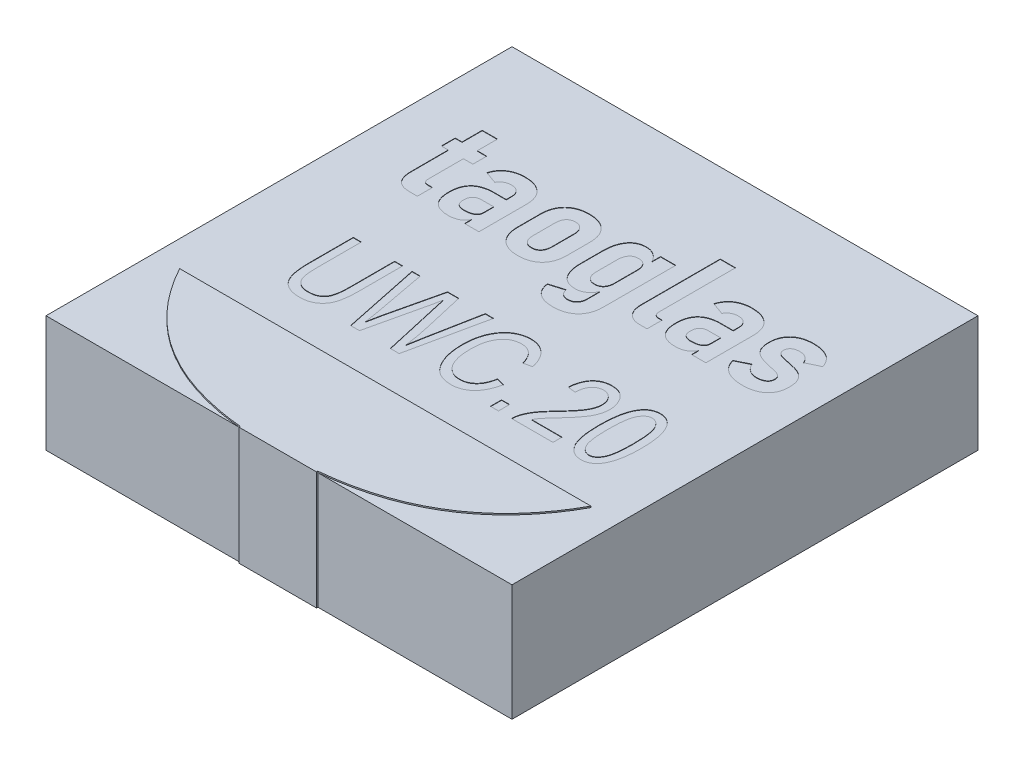
from build123d import *

# Parameters (mm, degrees)
SKETCH1_W           = 12
SKETCH1_H           = 12
BOSS_EXTRUDE1_DEPTH = 3
CUT_EXTRUDE1_DEPTH  = 0.01
SKETCH3_W           = 0.207792207
SKETCH3_H           = 0.285714285
CUT_EXTRUDE2_DEPTH  = 0.01
BOSS_EXTRUDE2_DEPTH = 0.035
SKETCH5_W           = 2
SKETCH5_H           = 3.035
BOSS_EXTRUDE3_DEPTH = 0.035
SKETCH6_W           = 1.8
SKETCH6_H           = 1.8
BOSS_EXTRUDE4_DEPTH = 0.035


with BuildPart() as part:
    # Sketch1 → Boss-Extrude1 (new body)
    with BuildSketch(Plane(origin=(0, 0, 0), x_dir=(1, 0, 0), z_dir=(0, 1, 0))):
        Rectangle(SKETCH1_W, SKETCH1_H)
    extrude(amount=BOSS_EXTRUDE1_DEPTH)

    # Sketch2 → Cut-Extrude1 (cut)
    # profile 1 of 11: a face of its own
    with BuildSketch(Plane(origin=(0, 3, 0), x_dir=(1, 0, 0), z_dir=(0, 1, 0))):
        with BuildLine():
            add(Edge.make_bspline(
                [(-4.082177573, 1.446921313), (-4.100452175, 1.447341427), (-4.135906195, 1.448156476), (-4.187220197, 1.453544619), (-4.2346967, 1.46334355), (-4.278580423, 1.476187937), (-4.318323244, 1.493621213), (-4.354377838, 1.514353743), (-4.386018142, 1.539618171), (-4.414162997, 1.568206993), (-4.438702104, 1.600431604), (-4.459369568, 1.636238764), (-4.477259094, 1.675106119), (-4.492048609, 1.717356499), (-4.502939084, 1.763136003), (-4.510972452, 1.811957411), (-4.516280305, 1.863978992), (-4.516714369, 1.899762091), (-4.516938124, 1.918207839)],
                knots=[0, 0, 0, 0, 1.191236669, 2.31108333, 3.357341899, 4.347642879, 5.285519943, 6.179695054, 7.05074459, 7.915916153, 8.788916218, 9.68309133, 10.605358333, 11.574453392, 12.595678506, 13.668425922, 14.798102147, 16, 16, 16, 16], degree=3))
            Line((-4.516938124, 1.918207839), (-4.518967345, 3.752116119))
            Line((-4.518967345, 3.752116119), (-4.12682043, 3.752116119))
            Line((-4.12682043, 3.752116119), (-4.12682043, 1.974518716))
            add(Edge.make_bspline(
                [(-4.12682043, 1.974518716), (-4.126350354, 1.964363804), (-4.125450969, 1.944934666), (-4.120926699, 1.917302047), (-4.111256442, 1.893563012), (-4.099577378, 1.872772427), (-4.083191339, 1.856764231), (-4.064170351, 1.844571469), (-4.041476909, 1.838088327), (-4.025564639, 1.83706625), (-4.017242508, 1.836531703)],
                knots=[0, 0, 0, 0, 1.225087291, 2.343928598, 3.350275553, 4.300622686, 5.193783201, 6.081349753, 6.996544259, 8, 8, 8, 8], degree=3))
            Line((-4.017242508, 1.836531703), (-3.883821241, 1.836531703))
            Line((-3.883821241, 1.836531703), (-3.883821241, 1.446921313))
            Line((-3.883821241, 1.446921313), (-4.082177573, 1.446921313))
        make_face()
    # profile 2 of 11: a face of its own
    with BuildSketch(Plane(origin=(0, 3, 0), x_dir=(1, 0, 0), z_dir=(0, 1, 0))):
        Polygon((-4.695002248, 2.875492742), (-4.695002248, 3.232635599), (-3.883821241, 3.232635599), (-3.883821241, 2.877014657), align=None)
    # profile 3 of 11: a face of its own
    with BuildSketch(Plane(origin=(0, 3, 0), x_dir=(1, 0, 0), z_dir=(0, 1, 0))):
        with BuildLine():
            Line((-2.666796079, 1.446921313), (-2.666796079, 2.657351508))
            add(Edge.make_bspline(
                [(-2.666796079, 2.657351508), (-2.667429235, 2.676374986), (-2.668632691, 2.712533435), (-2.681579146, 2.763217525), (-2.70255951, 2.807240876), (-2.732536643, 2.843884389), (-2.770629728, 2.87288561), (-2.816098819, 2.893825986), (-2.86926266, 2.906005823), (-2.907022366, 2.907283051), (-2.927043644, 2.907960274)],
                knots=[0, 0, 0, 0, 1.108007834, 2.106021114, 3.028382045, 3.933048714, 4.840938672, 5.798927425, 6.832928287, 8, 8, 8, 8], degree=3))
            add(Edge.make_bspline(
                [(-2.927043644, 2.907960274), (-2.941288479, 2.90750721), (-2.969311849, 2.906615911), (-3.010133896, 2.898545411), (-3.049252741, 2.886648756), (-3.085642505, 2.868675975), (-3.119212618, 2.846486276), (-3.149199296, 2.819579641), (-3.175291528, 2.788236593), (-3.188665331, 2.764290596), (-3.195408092, 2.75221758)],
                knots=[0, 0, 0, 0, 1.044624406, 2.05505343, 3.044444796, 4.038265424, 5.022972885, 5.989993332, 6.986601247, 8, 8, 8, 8], degree=3))
            Line((-3.195408092, 2.75221758), (-3.512473839, 2.866868554))
            add(Edge.make_bspline(
                [(-3.512473839, 2.866868554), (-3.507898959, 2.882375579), (-3.498902473, 2.912870089), (-3.479894394, 2.956060796), (-3.459623181, 2.997414601), (-3.435067806, 3.03552829), (-3.407252646, 3.070724952), (-3.377061273, 3.104032425), (-3.342718827, 3.133641979), (-3.306237387, 3.161416169), (-3.266607742, 3.185462269), (-3.224681197, 3.20711185), (-3.180189234, 3.225216266), (-3.133364715, 3.239982495), (-3.08429137, 3.251074459), (-3.032939676, 3.259090998), (-2.979069664, 3.264416299), (-2.942275904, 3.264871003), (-2.923492508, 3.265103132)],
                knots=[0, 0, 0, 0, 1.007667858, 1.981575232, 2.939405765, 3.878872876, 4.803290341, 5.736575898, 6.678468818, 7.628012353, 8.59428922, 9.566308898, 10.569437439, 11.587162715, 12.626264854, 13.705151769, 14.828468663, 16, 16, 16, 16], degree=3))
            add(Edge.make_bspline(
                [(-2.923492508, 3.265103132), (-2.899463722, 3.264592037), (-2.852650585, 3.263596317), (-2.784583947, 3.256584049), (-2.720580171, 3.244404684), (-2.660791503, 3.227260293), (-2.604849072, 3.205286254), (-2.552926173, 3.178592167), (-2.505533904, 3.146229429), (-2.462110077, 3.109719282), (-2.423704894, 3.06851092), (-2.389685512, 3.023731032), (-2.361924456, 2.974333625), (-2.338188924, 2.921525683), (-2.320840376, 2.864134833), (-2.307390491, 2.803138178), (-2.299917983, 2.738029571), (-2.298975068, 2.693387934), (-2.298492508, 2.670541443)],
                knots=[0, 0, 0, 0, 1.176545431, 2.29215836, 3.3461137, 4.362952169, 5.333208681, 6.28502252, 7.215158746, 8.137559586, 9.057280537, 9.968124497, 10.884260069, 11.825898436, 12.797531975, 13.814235576, 14.881379608, 16, 16, 16, 16], degree=3))
            Line((-2.298492508, 2.670541443), (-2.298492508, 1.446921313))
            Line((-2.298492508, 1.446921313), (-2.666796079, 1.446921313))
        make_face()
    # profile 4 of 11: a face of its own
    with BuildSketch(Plane(origin=(0, 3, 0), x_dir=(1, 0, 0), z_dir=(0, 1, 0))):
        with BuildLine():
            add(Edge.make_bspline(
                [(-3.056913774, 1.414453781), (-3.077727495, 1.414823769), (-3.117928312, 1.415538385), (-3.17633909, 1.42158332), (-3.230802782, 1.43226344), (-3.281400462, 1.446859634), (-3.328314866, 1.465145275), (-3.371211578, 1.487934663), (-3.409734227, 1.515602488), (-3.444879211, 1.546689147), (-3.475305723, 1.582550662), (-3.502005253, 1.622484987), (-3.524197353, 1.666879595), (-3.54256703, 1.715486923), (-3.556598981, 1.768375042), (-3.566619321, 1.825397293), (-3.572800732, 1.886618821), (-3.573497548, 1.928846021), (-3.573857767, 1.950675372)],
                knots=[0, 0, 0, 0, 1.168739368, 2.257370418, 3.292927306, 4.281748364, 5.211137899, 6.116140593, 7.001547475, 7.869100852, 8.744674127, 9.634957082, 10.560846446, 11.525661171, 12.548511358, 13.628992737, 14.774307786, 16, 16, 16, 16], degree=3))
            add(Edge.make_bspline(
                [(-3.573857767, 1.950675372), (-3.573309418, 1.973686511), (-3.572250688, 2.018115494), (-3.565863773, 2.082655172), (-3.554107555, 2.142718219), (-3.538137275, 2.198536344), (-3.517245182, 2.250035533), (-3.491203203, 2.29663685), (-3.461272158, 2.339473819), (-3.425736114, 2.377106043), (-3.386069509, 2.410863821), (-3.341531087, 2.43987399), (-3.292494367, 2.464338238), (-3.238942671, 2.483835274), (-3.181156234, 2.499841384), (-3.118800967, 2.510638514), (-3.051823274, 2.517423224), (-3.005693608, 2.51803397), (-2.981832605, 2.518349885)],
                knots=[0, 0, 0, 0, 1.174360603, 2.267408312, 3.304813126, 4.293371611, 5.226001371, 6.13370687, 7.012443309, 7.885526464, 8.767223756, 9.664740885, 10.590921095, 11.557465696, 12.568589945, 13.646822493, 14.782796878, 16, 16, 16, 16], degree=3))
            Line((-2.981832605, 2.518349885), (-2.654620754, 2.518349885))
            Line((-2.654620754, 2.518349885), (-2.628748189, 2.195196476))
            Line((-2.628748189, 2.195196476), (-2.974730332, 2.19367456))
            add(Edge.make_bspline(
                [(-2.974730332, 2.19367456), (-2.99306347, 2.193349125), (-3.027594206, 2.192736164), (-3.076064874, 2.181333351), (-3.117757299, 2.162240708), (-3.15162492, 2.133791573), (-3.178444422, 2.09786743), (-3.195666779, 2.053357692), (-3.206564374, 2.001770385), (-3.207229545, 1.964776037), (-3.207583417, 1.945095015)],
                knots=[0, 0, 0, 0, 1.119640328, 2.108859057, 3.025616394, 3.900328462, 4.788472712, 5.739984025, 6.797669766, 8, 8, 8, 8], degree=3))
            add(Edge.make_bspline(
                [(-3.207583417, 1.945095015), (-3.207273526, 1.928773445), (-3.206686996, 1.897881652), (-3.194958804, 1.854838237), (-3.177008616, 1.817534271), (-3.149352787, 1.787514117), (-3.113764426, 1.765283403), (-3.071178799, 1.748724503), (-3.020901818, 1.740097671), (-2.985074777, 1.739464394), (-2.966106144, 1.739129106)],
                knots=[0, 0, 0, 0, 1.069368935, 2.023991879, 2.909008863, 3.766792373, 4.667246662, 5.645845189, 6.753592325, 8, 8, 8, 8], degree=3))
            add(Edge.make_bspline(
                [(-2.966106144, 1.739129106), (-2.942894158, 1.740334767), (-2.899096293, 1.742609686), (-2.838122803, 1.75310898), (-2.786149964, 1.768604017), (-2.7425689, 1.789045123), (-2.708326557, 1.817143204), (-2.683326973, 1.852517831), (-2.668907363, 1.895688315), (-2.667524447, 1.926721125), (-2.666796079, 1.943065794)],
                knots=[0, 0, 0, 0, 1.362019611, 2.569946089, 3.617508551, 4.535416919, 5.373309674, 6.184796531, 7.043950598, 8, 8, 8, 8], degree=3))
            Line((-2.666796079, 1.943065794), (-2.632299326, 1.744202157))
            add(Edge.make_bspline(
                [(-2.632299326, 1.744202157), (-2.635184172, 1.7264977), (-2.640765207, 1.69224659), (-2.657119825, 1.644007436), (-2.677607014, 1.59981475), (-2.704417822, 1.560805739), (-2.734994506, 1.525755648), (-2.770130616, 1.495822527), (-2.809479468, 1.470659281), (-2.852483467, 1.449761251), (-2.899403361, 1.434544978), (-2.949004265, 1.422385059), (-3.001967129, 1.416133386), (-3.038299337, 1.415022786), (-3.056913774, 1.414453781)],
                knots=[0, 0, 0, 0, 1.085248998, 2.099526862, 3.075822976, 4.027942046, 4.957233502, 5.887541379, 6.814173588, 7.781229844, 8.776064882, 9.797615496, 10.871630686, 12, 12, 12, 12], degree=3))
        make_face()
    # profile 5 of 11: a face of its own
    with BuildSketch(Plane(origin=(0, 3, 0), x_dir=(1, 0, 0), z_dir=(0, 1, 0))):
        with BuildLine():
            add(Edge.make_bspline(
                [(-1.269170267, 1.414453781), (-1.29354723, 1.414869542), (-1.34125973, 1.415683303), (-1.410627342, 1.424100408), (-1.476135126, 1.436910411), (-1.537059317, 1.456100994), (-1.594549349, 1.478870641), (-1.647009629, 1.509031574), (-1.695947569, 1.543287444), (-1.74031673, 1.583204366), (-1.779902599, 1.627727662), (-1.813992671, 1.676923831), (-1.843318748, 1.729974233), (-1.86629921, 1.787553403), (-1.884860694, 1.849136013), (-1.897775393, 1.914879493), (-1.905618449, 1.984979164), (-1.906098568, 2.033006426), (-1.906345592, 2.057716768)],
                knots=[0, 0, 0, 0, 1.136233247, 2.223924638, 3.253914315, 4.244165647, 5.198961104, 6.131116221, 7.058824439, 7.980243949, 8.907549894, 9.830722435, 10.765941232, 11.728035834, 12.715992404, 13.761442677, 14.848247546, 16, 16, 16, 16], degree=3))
            Line((-1.906345592, 2.057716768), (-1.906345592, 2.630464333))
            add(Edge.make_bspline(
                [(-1.906345592, 2.630464333), (-1.906092767, 2.655004241), (-1.905601462, 2.702691658), (-1.897860293, 2.772141703), (-1.884672677, 2.837307505), (-1.866534841, 2.898354354), (-1.843149667, 2.955273405), (-1.814140247, 3.007649241), (-1.779874629, 3.055922204), (-1.7401511, 3.099445514), (-1.695919907, 3.138786124), (-1.647150081, 3.172702843), (-1.59424462, 3.201459079), (-1.53719546, 3.224699683), (-1.476017118, 3.242923861), (-1.410683846, 3.256186157), (-1.341215345, 3.263679032), (-1.293538651, 3.264621447), (-1.269170267, 3.265103132)],
                knots=[0, 0, 0, 0, 1.150912406, 2.236521831, 3.272853087, 4.266892441, 5.220231884, 6.154258736, 7.070147418, 7.99134763, 8.913162682, 9.842019137, 10.772230104, 11.732904174, 12.726943528, 13.763274784, 14.856771039, 16, 16, 16, 16], degree=3))
            add(Edge.make_bspline(
                [(-1.269170267, 3.265103132), (-1.244801283, 3.264629138), (-1.197291527, 3.263705039), (-1.127997696, 3.256145219), (-1.062840017, 3.242904879), (-1.001768641, 3.22482231), (-0.945010456, 3.201305966), (-0.892271125, 3.172857526), (-0.84394751, 3.138749172), (-0.800166259, 3.099461987), (-0.761055778, 3.055737375), (-0.726622508, 3.007812684), (-0.698342566, 2.955115908), (-0.674850024, 2.898369672), (-0.656562557, 2.837366446), (-0.644211009, 2.772073528), (-0.636240185, 2.702701286), (-0.635781908, 2.655007512), (-0.635546079, 2.630464333)],
                knots=[0, 0, 0, 0, 1.145973614, 2.23418936, 3.273008631, 4.269434466, 5.225062677, 6.157506887, 7.082082515, 8.000170054, 8.918257593, 9.836345132, 10.768789341, 11.724417553, 12.720843388, 13.758108748, 14.846324494, 16, 16, 16, 16], degree=3))
            Line((-0.635546079, 2.630464333), (-0.635546079, 2.052643716))
            add(Edge.make_bspline(
                [(-0.635546079, 2.052643716), (-0.635789995, 2.028101247), (-0.63626566, 1.980240673), (-0.644169742, 1.910692729), (-0.656550689, 1.845228832), (-0.674948694, 1.784101548), (-0.698332284, 1.726987193), (-0.726613149, 1.673784637), (-0.761062944, 1.625373146), (-0.800007578, 1.58114004), (-0.843944589, 1.541798185), (-0.892415256, 1.507820053), (-0.944842374, 1.478591285), (-1.001895553, 1.455480077), (-1.062661032, 1.436269302), (-1.128123177, 1.424322402), (-1.197237012, 1.415606156), (-1.244789296, 1.414844366), (-1.269170267, 1.414453781)],
                knots=[0, 0, 0, 0, 1.150786461, 2.244163054, 3.278830884, 4.272761459, 5.233330401, 6.170417134, 7.092677431, 8.014391608, 8.930180063, 9.85244036, 10.786365001, 11.739600119, 12.735839332, 13.770507161, 14.856896144, 16, 16, 16, 16], degree=3))
        make_face()
        with BuildLine():
            add(Edge.make_bspline(
                [(-1.271199488, 1.771596638), (-1.252643798, 1.772288226), (-1.217285078, 1.773606078), (-1.167864628, 1.788663516), (-1.124335163, 1.81131833), (-1.088864287, 1.845179032), (-1.05995529, 1.886558498), (-1.040543068, 1.936677124), (-1.028107181, 1.993694874), (-1.026838816, 2.034307062), (-1.026171079, 2.055687547)],
                knots=[0, 0, 0, 0, 1.043057802, 1.987594517, 2.888009663, 3.785541369, 4.724670203, 5.712877265, 6.795933051, 8, 8, 8, 8], degree=3))
            Line((-1.026171079, 2.055687547), (-1.026171079, 2.627420502))
            add(Edge.make_bspline(
                [(-1.026171079, 2.627420502), (-1.026817937, 2.648637524), (-1.028041187, 2.688760281), (-1.040652145, 2.745058586), (-1.059816576, 2.794465586), (-1.089015261, 2.835044285), (-1.124638638, 2.868095282), (-1.167604503, 2.891678405), (-1.217409983, 2.90573058), (-1.252670574, 2.90719221), (-1.271199488, 2.907960274)],
                knots=[0, 0, 0, 0, 1.203141769, 2.275218587, 3.261641283, 4.1917873, 5.089270432, 6.000779579, 6.94943949, 8, 8, 8, 8], degree=3))
            add(Edge.make_bspline(
                [(-1.271199488, 2.907960274), (-1.289390042, 2.907183297), (-1.324148735, 2.905698642), (-1.373434661, 2.891593722), (-1.41625148, 2.867938837), (-1.45241293, 2.835249552), (-1.481432384, 2.794324325), (-1.50140139, 2.745200287), (-1.513798484, 2.688737237), (-1.515055748, 2.648629554), (-1.515720592, 2.627420502)],
                knots=[0, 0, 0, 0, 1.033686927, 1.97517941, 2.888695558, 3.795287172, 4.727481225, 5.719771738, 6.794209101, 8, 8, 8, 8], degree=3))
            Line((-1.515720592, 2.627420502), (-1.515720592, 2.055687547))
            add(Edge.make_bspline(
                [(-1.515720592, 2.055687547), (-1.515034836, 2.034314967), (-1.513732245, 1.993717795), (-1.50151313, 1.936535725), (-1.481290619, 1.886699783), (-1.45256819, 1.844972846), (-1.41655531, 1.811470509), (-1.373174456, 1.788747701), (-1.324273285, 1.773641456), (-1.289416465, 1.772298498), (-1.271199488, 1.771596638)],
                knots=[0, 0, 0, 0, 1.206707764, 2.292138957, 3.28615018, 4.227338753, 5.133869778, 6.036259756, 6.973704081, 8, 8, 8, 8], degree=3))
        make_face(mode=Mode.SUBTRACT)
    # profile 6 of 11: a face of its own
    with BuildSketch(Plane(origin=(0, 3, 0), x_dir=(1, 0, 0), z_dir=(0, 1, 0))):
        with BuildLine():
            add(Edge.make_bspline(
                [(0.318187687, 0.724518716), (0.298047045, 0.72469497), (0.258696956, 0.72503933), (0.201310264, 0.731101208), (0.146966653, 0.73926428), (0.096032714, 0.751750756), (0.047906352, 0.766576912), (0.003337182, 0.786214833), (-0.038575447, 0.808249272), (-0.076832359, 0.834501871), (-0.112081146, 0.863677806), (-0.142988526, 0.897206587), (-0.171222458, 0.933272093), (-0.195604669, 0.972899867), (-0.215814396, 1.016116923), (-0.233333484, 1.062278088), (-0.24624632, 1.112211023), (-0.252420272, 1.146721322), (-0.255574488, 1.16435232)],
                knots=[0, 0, 0, 0, 1.205301849, 2.35487697, 3.451880311, 4.493170122, 5.492252228, 6.462809998, 7.40506802, 8.323411719, 9.236100227, 10.13867913, 11.04804784, 11.975390222, 12.917430608, 13.901051796, 14.92766644, 16, 16, 16, 16], degree=3))
            Line((-0.255574488, 1.16435232), (-0.257096404, 1.165874235))
            Line((-0.257096404, 1.165874235), (0.11628022, 1.277988683))
            add(Edge.make_bspline(
                [(0.11628022, 1.277988683), (0.120466826, 1.262815989), (0.128501856, 1.233696203), (0.146253956, 1.193377644), (0.169219888, 1.159148306), (0.196462809, 1.130495496), (0.228250352, 1.108405093), (0.264234021, 1.093207101), (0.303601042, 1.083089216), (0.331311424, 1.082146875), (0.345582168, 1.081661573)],
                knots=[0, 0, 0, 0, 1.145028287, 2.197564733, 3.191211535, 4.131565532, 5.060486474, 5.986793033, 6.96320588, 8, 8, 8, 8], degree=3))
            add(Edge.make_bspline(
                [(0.345582168, 1.081661573), (0.36375461, 1.082537579), (0.398552077, 1.084214998), (0.448059223, 1.097028072), (0.491540082, 1.119009), (0.528173443, 1.150349132), (0.558195565, 1.189076194), (0.578287759, 1.236245806), (0.590781565, 1.289847547), (0.591667126, 1.327965588), (0.592132492, 1.3479968)],
                knots=[0, 0, 0, 0, 1.057951135, 2.025815749, 2.955569453, 3.871437606, 4.81337937, 5.783748165, 6.835349051, 8, 8, 8, 8], degree=3))
            Line((0.592132492, 1.3479968), (0.593654408, 3.232635599))
            Line((0.593654408, 3.232635599), (0.984279408, 3.232635599))
            Line((0.984279408, 3.232635599), (0.984279408, 1.366767093))
            add(Edge.make_bspline(
                [(0.984279408, 1.366767093), (0.983915413, 1.342048164), (0.983204971, 1.293801947), (0.974098192, 1.223592971), (0.960728959, 1.157682742), (0.94193777, 1.095826424), (0.917011142, 1.038609905), (0.886904468, 0.985275605), (0.85132384, 0.936252148), (0.809910012, 0.892215805), (0.764333903, 0.852305318), (0.713555464, 0.818218948), (0.658435418, 0.789207558), (0.598960508, 0.765331838), (0.534987405, 0.747136055), (0.466746049, 0.734120121), (0.393984839, 0.725727465), (0.343915229, 0.724928997), (0.318187687, 0.724518716)],
                knots=[0, 0, 0, 0, 1.127370786, 2.200393757, 3.225038303, 4.194122408, 5.144622546, 6.067367868, 6.984253609, 7.901593912, 8.820685424, 9.743204824, 10.685619201, 11.658659081, 12.662517363, 13.715907218, 14.826352111, 16, 16, 16, 16], degree=3))
        make_face()
    # profile 7 of 11: a face of its own
    with BuildSketch(Plane(origin=(0, 3, 0), x_dir=(1, 0, 0), z_dir=(0, 1, 0))):
        with BuildLine():
            add(Edge.make_bspline(
                [(0.205058629, 1.414453781), (0.186263532, 1.414926958), (0.149526978, 1.415851822), (0.095894608, 1.423491154), (0.04551734, 1.436641776), (-0.001385014, 1.45505162), (-0.045183298, 1.478011535), (-0.085577566, 1.506540793), (-0.121945631, 1.541040827), (-0.15590081, 1.579510405), (-0.184944843, 1.623564233), (-0.211221157, 1.671402397), (-0.232578464, 1.723841992), (-0.251189165, 1.780008474), (-0.265213912, 1.840646084), (-0.275187047, 1.905425687), (-0.281274261, 1.974406074), (-0.282392661, 2.021685709), (-0.282968969, 2.046048748)],
                knots=[0, 0, 0, 0, 0.998875488, 1.952383794, 2.872550872, 3.760673895, 4.625281568, 5.495804423, 6.379960249, 7.284850293, 8.217362134, 9.178762493, 10.182158532, 11.222643449, 12.321639619, 13.486291024, 14.704694071, 16, 16, 16, 16], degree=3))
            Line((-0.282968969, 2.046048748), (-0.282968969, 2.627927807))
            add(Edge.make_bspline(
                [(-0.282968969, 2.627927807), (-0.282393852, 2.652460306), (-0.281277541, 2.700078275), (-0.275170972, 2.769558457), (-0.265264296, 2.834865448), (-0.251018914, 2.895881824), (-0.233233554, 2.952768491), (-0.211668894, 3.005575555), (-0.185532414, 3.054013727), (-0.156162641, 3.09831101), (-0.123367335, 3.138180964), (-0.086419523, 3.172248607), (-0.046701213, 3.201699563), (-0.003134826, 3.224952356), (0.043335883, 3.243326332), (0.092993933, 3.256620651), (0.146133184, 3.264349865), (0.182711169, 3.264847442), (0.201507492, 3.265103132)],
                knots=[0, 0, 0, 0, 1.301027643, 2.525315178, 3.69591381, 4.800891658, 5.84456841, 6.853735481, 7.820622285, 8.758249379, 9.668725885, 10.550670002, 11.416975573, 12.28365235, 13.161209114, 14.061739611, 15.003986428, 16, 16, 16, 16], degree=3))
            add(Edge.make_bspline(
                [(0.201507492, 3.265103132), (0.223748537, 3.264358252), (0.267763275, 3.262884145), (0.332362908, 3.246943883), (0.393818042, 3.220204003), (0.451737903, 3.182692282), (0.505412982, 3.13624712), (0.55308628, 3.080334919), (0.595104005, 3.016131113), (0.616926748, 2.968485311), (0.628151161, 2.943978943)],
                knots=[0, 0, 0, 0, 0.939230242, 1.858724415, 2.794188441, 3.76246683, 4.766415157, 5.785863634, 6.861170619, 8, 8, 8, 8], degree=3))
            Line((0.628151161, 2.943978943), (0.592132492, 2.636551995))
            add(Edge.make_bspline(
                [(0.592132492, 2.636551995), (0.592109095, 2.650098218), (0.592063576, 2.67645241), (0.586791069, 2.714536774), (0.578266137, 2.749970816), (0.565980998, 2.782402308), (0.551132258, 2.812141008), (0.532093617, 2.837547817), (0.510418052, 2.859496912), (0.485378288, 2.877369829), (0.456980316, 2.890998947), (0.425708379, 2.901499191), (0.390904343, 2.906703827), (0.366733372, 2.907531381), (0.354206356, 2.907960274)],
                knots=[0, 0, 0, 0, 1.184568575, 2.304579583, 3.356493581, 4.368273284, 5.334865166, 6.255598593, 7.134821175, 8.026171538, 8.93311806, 9.883363628, 10.903017221, 12, 12, 12, 12], degree=3))
            add(Edge.make_bspline(
                [(0.354206356, 2.907960274), (0.335500038, 2.907053441), (0.299809616, 2.905323262), (0.249244148, 2.890254251), (0.205760699, 2.864369707), (0.169649772, 2.828503068), (0.14162509, 2.783936209), (0.121507443, 2.731904084), (0.108688928, 2.672661498), (0.106681764, 2.630703215), (0.105626811, 2.608650209)],
                knots=[0, 0, 0, 0, 1.020864556, 1.947742261, 2.851238358, 3.759684639, 4.70318682, 5.707218961, 6.794928901, 8, 8, 8, 8], degree=3))
            Line((0.105626811, 2.608650209), (0.105626811, 2.058731378))
            add(Edge.make_bspline(
                [(0.105626811, 2.058731378), (0.106295198, 2.037017643), (0.107560537, 1.995910912), (0.119944444, 1.937943961), (0.139931613, 1.887366395), (0.168773433, 1.844826545), (0.205415234, 1.810918473), (0.249797382, 1.787314333), (0.300767343, 1.773265508), (0.336863453, 1.772169462), (0.355728272, 1.771596638)],
                knots=[0, 0, 0, 0, 1.201702592, 2.27496858, 3.266775193, 4.197194913, 5.099153499, 6.004755004, 6.957230176, 8, 8, 8, 8], degree=3))
            add(Edge.make_bspline(
                [(0.355728272, 1.771596638), (0.367926877, 1.771786424), (0.391451951, 1.772152427), (0.42525342, 1.777831245), (0.456310125, 1.787418818), (0.484432514, 1.801707516), (0.509412209, 1.820411889), (0.532064123, 1.841944486), (0.550427745, 1.86826952), (0.56613758, 1.897476445), (0.578307584, 1.930271344), (0.586676758, 1.965713484), (0.592083429, 2.003606859), (0.592115832, 2.029626606), (0.592132492, 2.043004917)],
                knots=[0, 0, 0, 0, 1.071013031, 2.065454304, 3.000834164, 3.918091259, 4.821762204, 5.736124976, 6.651815448, 7.62922966, 8.64509703, 9.715697498, 10.825503262, 12, 12, 12, 12], degree=3))
            Line((0.592132492, 2.043004917), (0.615975837, 1.725431865))
            add(Edge.make_bspline(
                [(0.615975837, 1.725431865), (0.607445296, 1.703008876), (0.590715477, 1.659033635), (0.555653784, 1.59850496), (0.513297761, 1.544846096), (0.464167285, 1.49844361), (0.408307822, 1.460821734), (0.346056192, 1.433502415), (0.277368082, 1.417661811), (0.229660968, 1.415545271), (0.205058629, 1.414453781)],
                knots=[0, 0, 0, 0, 1.039952667, 2.039521501, 3.021858379, 3.998034276, 4.960875327, 5.930406727, 6.932720231, 8, 8, 8, 8], degree=3))
        make_face()
    # profile 8 of 11: a face of its own
    with BuildSketch(Plane(origin=(0, 3, 0), x_dir=(1, 0, 0), z_dir=(0, 1, 0))):
        with BuildLine():
            Line((1.808143044, 3.946921313), (1.808143044, 1.975026021))
            add(Edge.make_bspline(
                [(1.808143044, 1.975026021), (1.808471251, 1.964674335), (1.809091212, 1.945120669), (1.815361328, 1.91748082), (1.825439864, 1.893281324), (1.839622171, 1.872641463), (1.858028704, 1.856521909), (1.879567535, 1.844565297), (1.904682368, 1.838099307), (1.922252649, 1.837069108), (1.931418207, 1.836531703)],
                knots=[0, 0, 0, 0, 1.181340194, 2.231475248, 3.218550972, 4.162104532, 5.065626072, 5.990996165, 6.952000817, 8, 8, 8, 8], degree=3))
            Line((1.931418207, 1.836531703), (2.03034272, 1.836531703))
            Line((2.03034272, 1.836531703), (2.03034272, 1.446921313))
            Line((2.03034272, 1.446921313), (1.845683629, 1.446921313))
            add(Edge.make_bspline(
                [(1.845683629, 1.446921313), (1.829096658, 1.447335487), (1.796840385, 1.448140921), (1.749938366, 1.453667153), (1.705889703, 1.463271688), (1.664678556, 1.47713417), (1.626091306, 1.49413391), (1.590512093, 1.515280349), (1.557867805, 1.540349034), (1.527925455, 1.56915189), (1.501541697, 1.601817669), (1.478607061, 1.637548397), (1.459112953, 1.676459836), (1.443615102, 1.718927232), (1.430747606, 1.764308899), (1.422529169, 1.81313863), (1.416495343, 1.864958732), (1.41616588, 1.900770734), (1.415996129, 1.91922245)],
                knots=[0, 0, 0, 0, 1.096532794, 2.132400368, 3.117048326, 4.071596503, 5.002411487, 5.899725498, 6.800861876, 7.718014517, 8.639924558, 9.57026945, 10.520223694, 11.510756622, 12.555036251, 13.633988453, 14.780940183, 16, 16, 16, 16], degree=3))
            Line((1.415996129, 1.91922245), (1.415996129, 3.946921313))
            Line((1.415996129, 3.946921313), (1.808143044, 3.946921313))
        make_face()
    # profile 9 of 11: a face of its own
    with BuildSketch(Plane(origin=(0, 3, 0), x_dir=(1, 0, 0), z_dir=(0, 1, 0))):
        with BuildLine():
            Line((3.177359765, 1.446921313), (3.177359765, 2.657351508))
            add(Edge.make_bspline(
                [(3.177359765, 2.657351508), (3.176726609, 2.676374986), (3.175523153, 2.712533435), (3.162576698, 2.763217525), (3.141596334, 2.807240876), (3.111619201, 2.843884389), (3.073526116, 2.87288561), (3.028057025, 2.893825986), (2.974893185, 2.906005823), (2.937133478, 2.907283051), (2.9171122, 2.907960274)],
                knots=[0, 0, 0, 0, 1.108007834, 2.106021114, 3.028382045, 3.933048714, 4.840938672, 5.798927425, 6.832928287, 8, 8, 8, 8], degree=3))
            add(Edge.make_bspline(
                [(2.9171122, 2.907960274), (2.902867365, 2.90750721), (2.874843995, 2.906615911), (2.834021948, 2.898545411), (2.794903103, 2.886648756), (2.758513339, 2.868675975), (2.724943227, 2.846486276), (2.694956549, 2.819579641), (2.668864316, 2.788236593), (2.655490513, 2.764290596), (2.648747752, 2.75221758)],
                knots=[0, 0, 0, 0, 1.044624406, 2.05505343, 3.044444796, 4.038265424, 5.022972885, 5.989993332, 6.986601247, 8, 8, 8, 8], degree=3))
            Line((2.648747752, 2.75221758), (2.331682005, 2.866868554))
            add(Edge.make_bspline(
                [(2.331682005, 2.866868554), (2.336256886, 2.882375579), (2.345253371, 2.912870089), (2.36426145, 2.956060796), (2.384532664, 2.997414601), (2.409088038, 3.03552829), (2.436903198, 3.070724952), (2.467094571, 3.104032425), (2.501437017, 3.133641979), (2.537918458, 3.161416169), (2.577548103, 3.185462269), (2.619474647, 3.20711185), (2.66396661, 3.225216266), (2.710791129, 3.239982495), (2.759864474, 3.251074459), (2.811216168, 3.259090998), (2.86508618, 3.264416299), (2.90187994, 3.264871003), (2.920663337, 3.265103132)],
                knots=[0, 0, 0, 0, 1.007667858, 1.981575232, 2.939405765, 3.878872876, 4.803290341, 5.736575898, 6.678468818, 7.628012353, 8.59428922, 9.566308898, 10.569437439, 11.587162715, 12.626264854, 13.705151769, 14.828468663, 16, 16, 16, 16], degree=3))
            add(Edge.make_bspline(
                [(2.920663337, 3.265103132), (2.944692122, 3.264592037), (2.991505259, 3.263596317), (3.059571897, 3.256584049), (3.123575673, 3.244404684), (3.183364341, 3.227260293), (3.239306772, 3.205286254), (3.291229671, 3.178592167), (3.33862194, 3.146229429), (3.382045767, 3.109719282), (3.42045095, 3.06851092), (3.454470332, 3.023731032), (3.482231388, 2.974333625), (3.50596692, 2.921525683), (3.523315468, 2.864134833), (3.536765353, 2.803138178), (3.544237861, 2.738029571), (3.545180776, 2.693387934), (3.545663337, 2.670541443)],
                knots=[0, 0, 0, 0, 1.176545431, 2.29215836, 3.3461137, 4.362952169, 5.333208681, 6.28502252, 7.215158746, 8.137559586, 9.057280537, 9.968124497, 10.884260069, 11.825898436, 12.797531975, 13.814235576, 14.881379608, 16, 16, 16, 16], degree=3))
            Line((3.545663337, 2.670541443), (3.545663337, 1.446921313))
            Line((3.545663337, 1.446921313), (3.177359765, 1.446921313))
        make_face()
    # profile 10 of 11: a face of its own
    with BuildSketch(Plane(origin=(0, 3, 0), x_dir=(1, 0, 0), z_dir=(0, 1, 0))):
        with BuildLine():
            add(Edge.make_bspline(
                [(2.78724207, 1.414453781), (2.766428349, 1.414823769), (2.726227532, 1.415538385), (2.667816754, 1.42158332), (2.613353062, 1.43226344), (2.562755383, 1.446859634), (2.515840978, 1.465145275), (2.472944266, 1.487934663), (2.434421617, 1.515602488), (2.399276633, 1.546689147), (2.368850121, 1.582550662), (2.342150591, 1.622484987), (2.319958491, 1.666879595), (2.301588814, 1.715486923), (2.287556863, 1.768375042), (2.277536523, 1.825397293), (2.271355112, 1.886618821), (2.270658296, 1.928846021), (2.270298077, 1.950675372)],
                knots=[0, 0, 0, 0, 1.168739368, 2.257370418, 3.292927306, 4.281748364, 5.211137899, 6.116140593, 7.001547475, 7.869100852, 8.744674127, 9.634957082, 10.560846446, 11.525661171, 12.548511358, 13.628992737, 14.774307786, 16, 16, 16, 16], degree=3))
            add(Edge.make_bspline(
                [(2.270298077, 1.950675372), (2.270846426, 1.973686511), (2.271905156, 2.018115494), (2.278292071, 2.082655172), (2.29004829, 2.142718219), (2.306018569, 2.198536344), (2.326910662, 2.250035533), (2.352952641, 2.29663685), (2.382883686, 2.339473819), (2.418419731, 2.377106043), (2.458086335, 2.410863821), (2.502624757, 2.43987399), (2.551661477, 2.464338238), (2.605213173, 2.483835274), (2.662999611, 2.499841384), (2.725354878, 2.510638514), (2.79233257, 2.517423224), (2.838462237, 2.51803397), (2.862323239, 2.518349885)],
                knots=[0, 0, 0, 0, 1.174360603, 2.267408312, 3.304813126, 4.293371611, 5.226001371, 6.13370687, 7.012443309, 7.885526464, 8.767223756, 9.664740885, 10.590921095, 11.557465696, 12.568589945, 13.646822493, 14.782796878, 16, 16, 16, 16], degree=3))
            Line((2.862323239, 2.518349885), (3.18953509, 2.518349885))
            Line((3.18953509, 2.518349885), (3.215407655, 2.195196476))
            Line((3.215407655, 2.195196476), (2.869425512, 2.19367456))
            add(Edge.make_bspline(
                [(2.869425512, 2.19367456), (2.851092374, 2.193349125), (2.816561638, 2.192736164), (2.76809097, 2.181333351), (2.726398546, 2.162240708), (2.692530925, 2.133791573), (2.665711423, 2.09786743), (2.648489065, 2.053357692), (2.63759147, 2.001770385), (2.636926299, 1.964776037), (2.636572427, 1.945095015)],
                knots=[0, 0, 0, 0, 1.119640328, 2.108859057, 3.025616394, 3.900328462, 4.788472712, 5.739984025, 6.797669766, 8, 8, 8, 8], degree=3))
            add(Edge.make_bspline(
                [(2.636572427, 1.945095015), (2.636882318, 1.928773445), (2.637468848, 1.897881652), (2.64919704, 1.854838237), (2.667147228, 1.817534271), (2.694803057, 1.787514117), (2.730391418, 1.765283403), (2.772977046, 1.748724503), (2.823254026, 1.740097671), (2.859081067, 1.739464394), (2.8780497, 1.739129106)],
                knots=[0, 0, 0, 0, 1.069368935, 2.023991879, 2.909008863, 3.766792373, 4.667246662, 5.645845189, 6.753592325, 8, 8, 8, 8], degree=3))
            add(Edge.make_bspline(
                [(2.8780497, 1.739129106), (2.901261686, 1.740334767), (2.945059551, 1.742609686), (3.006033042, 1.75310898), (3.05800588, 1.768604017), (3.101586944, 1.789045123), (3.135829287, 1.817143204), (3.160828871, 1.852517831), (3.175248481, 1.895688315), (3.176631397, 1.926721125), (3.177359765, 1.943065794)],
                knots=[0, 0, 0, 0, 1.362019611, 2.569946089, 3.617508551, 4.535416919, 5.373309674, 6.184796531, 7.043950598, 8, 8, 8, 8], degree=3))
            Line((3.177359765, 1.943065794), (3.211856518, 1.744202157))
            add(Edge.make_bspline(
                [(3.211856518, 1.744202157), (3.208971672, 1.7264977), (3.203390638, 1.69224659), (3.187036019, 1.644007436), (3.166548831, 1.59981475), (3.139738022, 1.560805739), (3.109161338, 1.525755648), (3.074025229, 1.495822527), (3.034676377, 1.470659281), (2.991672377, 1.449761251), (2.944752484, 1.434544978), (2.895151579, 1.422385059), (2.842188715, 1.416133386), (2.805856508, 1.415022786), (2.78724207, 1.414453781)],
                knots=[0, 0, 0, 0, 1.085248998, 2.099526862, 3.075822976, 4.027942046, 4.957233502, 5.887541379, 6.814173588, 7.781229844, 8.776064882, 9.797615496, 10.871630686, 12, 12, 12, 12], degree=3))
        make_face()
    # profile 11 of 11: a face of its own
    with BuildSketch(Plane(origin=(0, 3, 0), x_dir=(1, 0, 0), z_dir=(0, 1, 0))):
        with BuildLine():
            add(Edge.make_bspline(
                [(4.510050512, 1.414453781), (4.488050727, 1.414624714), (4.445158249, 1.414957978), (4.382373588, 1.421087652), (4.322637407, 1.429204031), (4.265982647, 1.441776628), (4.211973683, 1.456506345), (4.161294593, 1.476120296), (4.113293767, 1.498308922), (4.068536943, 1.524150643), (4.027355028, 1.553674632), (3.989641927, 1.586425494), (3.954983982, 1.621758849), (3.924269276, 1.660745524), (3.897582155, 1.702892941), (3.873942937, 1.747930074), (3.854095852, 1.796182936), (3.844008226, 1.830008517), (3.838885739, 1.847185112)],
                knots=[0, 0, 0, 0, 1.218660145, 2.375993761, 3.493285337, 4.557594978, 5.590026914, 6.592591986, 7.56527609, 8.518486757, 9.452147081, 10.369053454, 11.283657966, 12.191128319, 13.114049761, 14.044647737, 15.007074142, 16, 16, 16, 16], degree=3))
            Line((3.838885739, 1.847185112), (4.170663337, 2.01003008))
            add(Edge.make_bspline(
                [(4.170663337, 2.01003008), (4.179651615, 1.991329596), (4.197082816, 1.955063262), (4.230500659, 1.906480732), (4.268259366, 1.864596989), (4.311184527, 1.830522481), (4.358401934, 1.803351166), (4.410368632, 1.785768293), (4.465650737, 1.773133916), (4.504055081, 1.772117716), (4.523747752, 1.771596638)],
                knots=[0, 0, 0, 0, 1.09616128, 2.125814083, 3.107204916, 4.068329831, 5.013631815, 5.972756641, 6.960486435, 8, 8, 8, 8], degree=3))
            add(Edge.make_bspline(
                [(4.523747752, 1.771596638), (4.544240121, 1.772312467), (4.583106597, 1.773670131), (4.638020741, 1.78280112), (4.685432304, 1.799772474), (4.725849894, 1.822375215), (4.75792325, 1.851764438), (4.781698041, 1.886460218), (4.795144606, 1.926917018), (4.796825872, 1.955314297), (4.797692557, 1.969952969)],
                knots=[0, 0, 0, 0, 1.292246278, 2.450915153, 3.493002879, 4.453106355, 5.351050601, 6.211565253, 7.078069714, 8, 8, 8, 8], degree=3))
            add(Edge.make_bspline(
                [(4.797692557, 1.969952969), (4.797042455, 1.983207026), (4.795811916, 2.008294833), (4.785807231, 2.043336186), (4.767825531, 2.072406265), (4.743074372, 2.095566756), (4.713076515, 2.113915571), (4.679542518, 2.130094742), (4.642038381, 2.144021184), (4.58554175, 2.15822044), (4.509145465, 2.175049065), (4.446648087, 2.188306785), (4.41416983, 2.195196476)],
                knots=[0, 0, 0, 0, 0.815225775, 1.543091783, 2.216194748, 2.893550537, 3.609709896, 4.373251239, 5.183477013, 6.067266454, 7.956260943, 10, 10, 10, 10], degree=3))
            add(Edge.make_bspline(
                [(4.41416983, 2.195196476), (4.383329479, 2.202550174), (4.3215756, 2.21727502), (4.230572584, 2.243840092), (4.143160793, 2.278525054), (4.076108767, 2.318170093), (4.02832397, 2.357433034), (3.995994358, 2.391792197), (3.96775174, 2.431197874), (3.942233638, 2.475125151), (3.922410496, 2.52568152), (3.908384256, 2.582798222), (3.900580578, 2.64665338), (3.899377086, 2.691319847), (3.898747752, 2.714676995)],
                knots=[0, 0, 0, 0, 1.402207606, 2.807742351, 4.189697507, 5.551899967, 6.231809274, 6.919652828, 7.631750779, 8.372041637, 9.160912365, 10.024364612, 10.966893683, 12, 12, 12, 12], degree=3))
            add(Edge.make_bspline(
                [(3.898747752, 2.714676995), (3.899208877, 2.735838471), (3.900108457, 2.777121045), (3.90786211, 2.837252587), (3.920463631, 2.893849179), (3.93807334, 2.946857066), (3.961244891, 2.995839278), (3.988617467, 3.041631185), (4.021963854, 3.083312709), (4.060058819, 3.121455869), (4.102722934, 3.15530001), (4.149322564, 3.185188381), (4.20019119, 3.20980272), (4.25486126, 3.230236366), (4.313482741, 3.245946411), (4.375985184, 3.256712072), (4.442392168, 3.264340756), (4.48804389, 3.264843844), (4.511572427, 3.265103132)],
                knots=[0, 0, 0, 0, 1.085932821, 2.118477045, 3.106150974, 4.058677473, 4.979017398, 5.882667548, 6.790975291, 7.711683573, 8.644385248, 9.581117633, 10.54777851, 11.539373683, 12.573267091, 13.657915462, 14.792908096, 16, 16, 16, 16], degree=3))
            add(Edge.make_bspline(
                [(4.511572427, 3.265103132), (4.53171027, 3.264891129), (4.571039237, 3.264477092), (4.628566431, 3.258905055), (4.68355003, 3.251714874), (4.735823333, 3.240610805), (4.785257533, 3.225737531), (4.83208154, 3.207999237), (4.876260532, 3.18727913), (4.91756039, 3.163411611), (4.955782594, 3.136241356), (4.991441188, 3.106562574), (5.023351794, 3.073255185), (5.052586717, 3.037605488), (5.078462215, 2.99881799), (5.101459747, 2.957175897), (5.120576752, 2.912286643), (5.131189125, 2.881144175), (5.136572427, 2.865346638)],
                knots=[0, 0, 0, 0, 1.205359069, 2.354051912, 3.458141153, 4.524629271, 5.549793508, 6.546508504, 7.520381629, 8.468650101, 9.398575935, 10.325575296, 11.24217454, 12.156253417, 13.083031538, 14.030164002, 15.000767848, 16, 16, 16, 16], degree=3))
            Line((5.136572427, 2.865346638), (4.804287525, 2.707574722))
            add(Edge.make_bspline(
                [(4.804287525, 2.707574722), (4.796528564, 2.722994343), (4.78144727, 2.752965862), (4.753431584, 2.793514265), (4.720901216, 2.827967508), (4.684957495, 2.856941962), (4.645577377, 2.880180702), (4.603043351, 2.896384176), (4.557534517, 2.906490293), (4.526169864, 2.907461261), (4.510050512, 2.907960274)],
                knots=[0, 0, 0, 0, 1.095840091, 2.130013011, 3.118067405, 4.096259792, 5.054423697, 6.010114917, 6.97733103, 8, 8, 8, 8], degree=3))
            add(Edge.make_bspline(
                [(4.510050512, 2.907960274), (4.491753846, 2.907415068), (4.456935538, 2.906377547), (4.407810319, 2.89762666), (4.365467369, 2.881713696), (4.329676357, 2.860401771), (4.301013381, 2.833212135), (4.280636264, 2.800204015), (4.268766159, 2.762134644), (4.267302694, 2.735223154), (4.266544018, 2.721271963)],
                knots=[0, 0, 0, 0, 1.265692078, 2.408594935, 3.434381642, 4.379585289, 5.273339999, 6.140344402, 7.035935596, 8, 8, 8, 8], degree=3))
            add(Edge.make_bspline(
                [(4.266544018, 2.721271963), (4.267060015, 2.709869732), (4.26804918, 2.688011686), (4.277442729, 2.657512261), (4.292455126, 2.63106212), (4.314019568, 2.609509573), (4.340539981, 2.592049202), (4.370418614, 2.576310088), (4.404269372, 2.563028061), (4.455557627, 2.54920985), (4.524962807, 2.534595439), (4.581740545, 2.523205658), (4.611004246, 2.517335274)],
                knots=[0, 0, 0, 0, 0.778325956, 1.492048727, 2.160839789, 2.839960281, 3.555649879, 4.32680456, 5.147576572, 6.037603213, 7.957748941, 10, 10, 10, 10], degree=3))
            add(Edge.make_bspline(
                [(4.611004246, 2.517335274), (4.643173103, 2.51058437), (4.707935447, 2.496993451), (4.788376898, 2.477212627), (4.85197168, 2.458244325), (4.897939423, 2.439995439), (4.941394073, 2.417332342), (4.983439167, 2.392342635), (5.022367614, 2.362156956), (5.05784101, 2.326539048), (5.087964573, 2.284365365), (5.115079674, 2.237149578), (5.136420842, 2.182719157), (5.151349464, 2.120618596), (5.160427752, 2.050712651), (5.161417455, 2.001435556), (5.161937687, 1.975533326)],
                knots=[0, 0, 0, 0, 1.590405861, 3.20180505, 4.006704468, 4.799831491, 5.590252742, 6.376086878, 7.163325468, 7.967559199, 8.798930906, 9.663617938, 10.596534749, 11.616559531, 12.747157834, 14, 14, 14, 14], degree=3))
            add(Edge.make_bspline(
                [(5.161937687, 1.975533326), (5.161534587, 1.953857915), (5.160750527, 1.911697595), (5.152243471, 1.850422372), (5.139359503, 1.792688535), (5.120472993, 1.738807162), (5.09657197, 1.688447782), (5.066815187, 1.642165451), (5.032304234, 1.599086994), (4.99187691, 1.560694986), (4.947158489, 1.525916315), (4.897650309, 1.496130195), (4.843980011, 1.470268986), (4.785354056, 1.450535374), (4.722851562, 1.434150457), (4.655854549, 1.422407502), (4.584407856, 1.416115407), (4.535258206, 1.415017085), (4.510050512, 1.414453781)],
                knots=[0, 0, 0, 0, 1.064563339, 2.070656454, 3.034287651, 3.967331112, 4.870586479, 5.767395968, 6.665552164, 7.576573355, 8.500803622, 9.444336216, 10.410830045, 11.42270722, 12.478933685, 13.584269813, 14.761029107, 16, 16, 16, 16], degree=3))
        make_face()
    extrude(amount=-CUT_EXTRUDE1_DEPTH, mode=Mode.SUBTRACT)

    # Sketch3 → Cut-Extrude2 (cut)
    # profile 1 of 6: a face of its own
    with BuildSketch(Plane(origin=(0, 3, 0), x_dir=(1, 0, 0), z_dir=(0, 1, 0))):
        with BuildLine():
            Line((-2.726414968, -0.29657855), (-2.51862276, -0.29657855))
            Line((-2.51862276, -0.29657855), (-2.51862276, -1.447552576))
            add(Edge.make_bspline(
                [(-2.51862276, -1.447552576), (-2.518718505, -1.471095897), (-2.518905667, -1.517118563), (-2.522123187, -1.584622652), (-2.525798063, -1.64894565), (-2.531899016, -1.71000862), (-2.540047347, -1.7676577), (-2.549770969, -1.822220034), (-2.561019385, -1.873565345), (-2.573914196, -1.921905434), (-2.589335645, -1.967264834), (-2.607706343, -2.010115758), (-2.628747331, -2.050525287), (-2.652281319, -2.088883375), (-2.679696906, -2.123942818), (-2.709491111, -2.157074917), (-2.741849129, -2.188005683), (-2.777361036, -2.216026717), (-2.815353237, -2.241317998), (-2.85635759, -2.262674983), (-2.899321107, -2.281613947), (-2.945188589, -2.29650369), (-2.993326059, -2.3083513), (-3.044135588, -2.316158609), (-3.097229559, -2.321814761), (-3.133595891, -2.322303356), (-3.152145487, -2.322552576)],
                knots=[0, 0, 0, 0, 1.368259962, 2.674685192, 3.927379338, 5.11271849, 6.240291004, 7.310705123, 8.333293867, 9.29464541, 10.217171785, 11.115419124, 12.001678669, 12.863498378, 13.726930742, 14.584327053, 15.451973921, 16.325090473, 17.210512476, 18.100427003, 19.00900841, 19.936480983, 20.899567414, 21.887185722, 22.92230397, 24, 24, 24, 24], degree=3))
            add(Edge.make_bspline(
                [(-3.152145487, -2.322552576), (-3.178017251, -2.322118454), (-3.228318263, -2.321274415), (-3.301095174, -2.311566478), (-3.369013142, -2.296832741), (-3.431955978, -2.275703964), (-3.489826675, -2.248445322), (-3.542963088, -2.215378701), (-3.590501994, -2.175707794), (-3.633620367, -2.129982522), (-3.67155685, -2.076179938), (-3.7037875, -2.013249144), (-3.730609188, -1.941173754), (-3.753473035, -1.860349375), (-3.770540125, -1.770153635), (-3.782235946, -1.670741449), (-3.790254137, -1.562265946), (-3.790975088, -1.486800069), (-3.791350033, -1.447552576)],
                knots=[0, 0, 0, 0, 0.994737873, 1.934012728, 2.819170121, 3.66513089, 4.482312726, 5.275081487, 6.06607151, 6.857729028, 7.686610991, 8.589807938, 9.569938202, 10.640863663, 11.817749818, 13.097224431, 14.490355297, 16, 16, 16, 16], degree=3))
            Line((-3.791350033, -1.447552576), (-3.791350033, -0.29657855))
            Line((-3.791350033, -0.29657855), (-3.583557825, -0.29657855))
            Line((-3.583557825, -0.29657855), (-3.583557825, -1.448770109))
            add(Edge.make_bspline(
                [(-3.583557825, -1.448770109), (-3.583381005, -1.470551928), (-3.583039368, -1.512637071), (-3.581029582, -1.57339773), (-3.577787912, -1.629555562), (-3.573570804, -1.681031198), (-3.567442881, -1.727726033), (-3.560226597, -1.769725451), (-3.551772719, -1.807138886), (-3.539301848, -1.850270477), (-3.518384713, -1.897699746), (-3.486966139, -1.948187257), (-3.448378807, -1.991293919), (-3.403239275, -2.027025558), (-3.351811649, -2.054793277), (-3.29509292, -2.074554107), (-3.233140928, -2.086602474), (-3.190216069, -2.088040955), (-3.167973409, -2.088786343)],
                knots=[0, 0, 0, 0, 1.192074946, 2.303234892, 3.32664993, 4.270430127, 5.129058668, 5.903188586, 6.601840961, 7.227304541, 8.357927402, 9.42602643, 10.469411778, 11.507741578, 12.5612693, 13.652443485, 14.78355105, 16, 16, 16, 16], degree=3))
            add(Edge.make_bspline(
                [(-3.167973409, -2.088786343), (-3.149286642, -2.088421226), (-3.113025646, -2.08771273), (-3.060735961, -2.081586048), (-3.012242304, -2.071645419), (-2.9679718, -2.056914429), (-2.92738465, -2.038733074), (-2.890735721, -2.016330994), (-2.858674457, -1.989229034), (-2.829624154, -1.958210343), (-2.80503131, -1.920519737), (-2.783483609, -1.875990869), (-2.766049866, -1.823350414), (-2.751068845, -1.763421389), (-2.740004709, -1.695530027), (-2.732113976, -1.620192504), (-2.727230551, -1.537037472), (-2.726695031, -1.479080213), (-2.726414968, -1.448770109)],
                knots=[0, 0, 0, 0, 0.994049587, 1.928917251, 2.797198979, 3.623526777, 4.406348786, 5.159482019, 5.900511621, 6.634126699, 7.412767256, 8.285246267, 9.259577949, 10.357749717, 11.569586172, 12.916231702, 14.387271204, 16, 16, 16, 16], degree=3))
            Line((-2.726414968, -1.448770109), (-2.726414968, -0.29657855))
        make_face()
    # profile 2 of 6: a face of its own
    with BuildSketch(Plane(origin=(0, 3, 0), x_dir=(1, 0, 0), z_dir=(0, 1, 0))):
        with BuildLine():
            Line((-1.859531851, -2.29657855), (-2.277145487, -0.29657855))
            Line((-2.277145487, -0.29657855), (-2.066106526, -0.29657855))
            Line((-2.066106526, -0.29657855), (-1.820570812, -1.607861018))
            add(Edge.make_bspline(
                [(-1.820570812, -1.607861018), (-1.807961794, -1.675429395), (-1.782596882, -1.811353223), (-1.762497086, -1.948154973), (-1.752388994, -2.016951927)],
                knots=[0, 0, 0, 0, 0.994209453, 2, 2, 2, 2], degree=3))
            Line((-1.752388994, -2.016951927), (-1.678119513, -1.647227901))
            Line((-1.678119513, -1.647227901), (-1.362778604, -0.29657855))
            Line((-1.362778604, -0.29657855), (-1.074629254, -0.29657855))
            Line((-1.074629254, -0.29657855), (-0.841268864, -1.308753875))
            add(Edge.make_bspline(
                [(-0.841268864, -1.308753875), (-0.827531196, -1.369693381), (-0.800431364, -1.489906678), (-0.766287236, -1.669041643), (-0.736584898, -1.844081414), (-0.721081863, -1.959814202), (-0.713427955, -2.016951927)],
                knots=[0, 0, 0, 0, 1.04116289, 2.053866719, 3.03918647, 4, 4, 4, 4], degree=3))
            add(Edge.make_bspline(
                [(-0.713427955, -2.016951927), (-0.708080218, -1.983526987), (-0.69705094, -1.914590734), (-0.67882094, -1.808653311), (-0.658414024, -1.697062168), (-0.643816124, -1.620972344), (-0.636317565, -1.581886992)],
                knots=[0, 0, 0, 0, 0.919271543, 1.895923682, 2.919191049, 4, 4, 4, 4], degree=3))
            Line((-0.636317565, -1.581886992), (-0.389970163, -0.29657855))
            Line((-0.389970163, -0.29657855), (-0.17974289, -0.29657855))
            Line((-0.17974289, -0.29657855), (-0.608720163, -2.29657855))
            Line((-0.608720163, -2.29657855), (-0.837210422, -2.29657855))
            Line((-0.837210422, -2.29657855), (-1.181366267, -0.772633745))
            Line((-1.181366267, -0.772633745), (-1.232908474, -0.538055823))
            add(Edge.make_bspline(
                [(-1.232908474, -0.538055823), (-1.236800868, -0.559300549), (-1.24439403, -0.600744109), (-1.255990582, -0.66114732), (-1.268273401, -0.718058064), (-1.276701986, -0.754785201), (-1.280798085, -0.772633745)],
                knots=[0, 0, 0, 0, 1.08241976, 2.111551282, 3.082257306, 4, 4, 4, 4], degree=3))
            Line((-1.280798085, -0.772633745), (-1.631041591, -2.29657855))
            Line((-1.631041591, -2.29657855), (-1.859531851, -2.29657855))
        make_face()
    # profile 3 of 6: a face of its own
    with BuildSketch(Plane(origin=(0, 3, 0), x_dir=(1, 0, 0), z_dir=(0, 1, 0))):
        with BuildLine():
            Line((1.22163698, -1.595279849), (1.429429188, -1.647227901))
            add(Edge.make_bspline(
                [(1.429429188, -1.647227901), (1.423235906, -1.674764183), (1.411161588, -1.728448445), (1.388514156, -1.805663951), (1.36205013, -1.877325938), (1.33249421, -1.943705889), (1.29960939, -2.004813985), (1.263557547, -2.060608196), (1.224035204, -2.111042916), (1.180845498, -2.15549708), (1.135430173, -2.19538424), (1.086731419, -2.228865638), (1.036214363, -2.258209018), (0.982913793, -2.281579753), (0.927367703, -2.30009047), (0.869277055, -2.312860029), (0.808877873, -2.321417201), (0.767662766, -2.322170998), (0.746799318, -2.322552576)],
                knots=[0, 0, 0, 0, 1.289221957, 2.51344498, 3.673011535, 4.776835723, 5.830430132, 6.840130389, 7.808269491, 8.7523986, 9.668123701, 10.564817631, 11.447926293, 12.333367568, 13.218722559, 14.118350969, 15.047492789, 16, 16, 16, 16], degree=3))
            add(Edge.make_bspline(
                [(0.746799318, -2.322552576), (0.728385579, -2.322298494), (0.692290331, -2.321800432), (0.639171197, -2.31617014), (0.587966494, -2.307946051), (0.53879477, -2.295564509), (0.491547705, -2.280406998), (0.446681469, -2.260940347), (0.403467025, -2.238785965), (0.362398991, -2.212604013), (0.322989449, -2.182943246), (0.286296035, -2.148456453), (0.250543845, -2.110758464), (0.217565009, -2.068047943), (0.185120904, -2.022027698), (0.155953207, -1.970977039), (0.127657061, -1.916389525), (0.101598637, -1.85782623), (0.077326955, -1.795876056), (0.057506, -1.730447025), (0.039827949, -1.662677866), (0.025797759, -1.592043326), (0.014221656, -1.518836867), (0.006890987, -1.442661169), (0.001709812, -1.363885011), (0.001144953, -1.310386237), (0.000857759, -1.283185693)],
                knots=[0, 0, 0, 0, 0.921095259, 1.805562833, 2.670327692, 3.514278933, 4.340642213, 5.150451062, 5.958900505, 6.768369716, 7.58482939, 8.423223242, 9.285360719, 10.181948201, 11.120907027, 12.10087379, 13.121233649, 14.196976745, 15.307105309, 16.44839936, 17.61583717, 18.810746038, 20.050660639, 21.323136918, 22.638994396, 24, 24, 24, 24], degree=3))
            add(Edge.make_bspline(
                [(0.000857759, -1.283185693), (0.001142608, -1.256390726), (0.001701284, -1.203837441), (0.006873975, -1.12668273), (0.014185991, -1.052526841), (0.025802881, -0.981624295), (0.039737095, -0.913666568), (0.057349158, -0.849105927), (0.077466712, -0.787411231), (0.1013889, -0.729172481), (0.12834612, -0.67434327), (0.157152168, -0.62269545), (0.187873817, -0.574224338), (0.221214247, -0.529426469), (0.256995465, -0.488413078), (0.294927058, -0.450773443), (0.335205998, -0.416741669), (0.377366222, -0.385701947), (0.421546286, -0.358800055), (0.466835023, -0.334909669), (0.513573132, -0.315087088), (0.561590042, -0.298798041), (0.61083934, -0.286136094), (0.661339584, -0.277430392), (0.712963598, -0.271290046), (0.747863209, -0.270834382), (0.765468149, -0.270604524)],
                knots=[0, 0, 0, 0, 1.355009242, 2.657595594, 3.909622363, 5.12221665, 6.289669639, 7.416642245, 8.504963989, 9.569716403, 10.597874851, 11.593392335, 12.559484071, 13.498222117, 14.414780627, 15.309839368, 16.198178116, 17.079506653, 17.954919271, 18.811820418, 19.667108407, 20.519600343, 21.37423126, 22.235899437, 23.110108003, 24, 24, 24, 24], degree=3))
            add(Edge.make_bspline(
                [(0.765468149, -0.270604524), (0.784695279, -0.271102311), (0.822463888, -0.272080133), (0.878249867, -0.278927592), (0.931615413, -0.291381519), (0.983458208, -0.307426352), (1.032805368, -0.329116185), (1.080294483, -0.355210663), (1.125511356, -0.386259787), (1.168485512, -0.422072311), (1.209170294, -0.462204936), (1.246644128, -0.507078079), (1.280564921, -0.556492796), (1.312250964, -0.609757202), (1.33954182, -0.668169543), (1.364148198, -0.730702584), (1.386551712, -0.797463103), (1.397726065, -0.844097591), (1.403455162, -0.868007122)],
                knots=[0, 0, 0, 0, 0.969230344, 1.90389736, 2.827024372, 3.728538081, 4.635631584, 5.539103428, 6.456494714, 7.396000419, 8.355610671, 9.333534695, 10.338037519, 11.374284513, 12.454112223, 13.583699076, 14.761161004, 16, 16, 16, 16], degree=3))
            Line((1.403455162, -0.868007122), (1.195662954, -0.919955174))
            add(Edge.make_bspline(
                [(1.195662954, -0.919955174), (1.190966427, -0.903127611), (1.181806788, -0.870308808), (1.165506951, -0.823171003), (1.147679413, -0.779251636), (1.128304312, -0.738432132), (1.106728565, -0.701066702), (1.083582775, -0.66685085), (1.058827325, -0.635689323), (1.031942244, -0.60823919), (1.003822307, -0.583471502), (0.973605828, -0.56225412), (0.941543694, -0.544528961), (0.90792563, -0.529628807), (0.872645401, -0.518421233), (0.835586996, -0.510166031), (0.796848916, -0.505296691), (0.770351842, -0.504681845), (0.756945422, -0.504370758)],
                knots=[0, 0, 0, 0, 1.274827499, 2.486296693, 3.637698816, 4.732866786, 5.781146847, 6.783409552, 7.745577291, 8.681189198, 9.583979081, 10.476943643, 11.369744444, 12.253932728, 13.156290603, 14.066553906, 15.021756508, 16, 16, 16, 16], degree=3))
            add(Edge.make_bspline(
                [(0.756945422, -0.504370758), (0.730483795, -0.505351135), (0.678847944, -0.507264191), (0.604166856, -0.523177263), (0.534680321, -0.548630828), (0.481793797, -0.579173562), (0.442581582, -0.608468611), (0.414787277, -0.633513629), (0.388616507, -0.661473218), (0.363750677, -0.692081128), (0.340196434, -0.725587706), (0.318955484, -0.762400864), (0.298355539, -0.80147622), (0.279792788, -0.843647873), (0.263255871, -0.888683936), (0.248547271, -0.936486944), (0.23600243, -0.987141498), (0.225883165, -1.040801779), (0.218359165, -1.097316068), (0.212558204, -1.156730856), (0.209443327, -1.219028849), (0.208917666, -1.26153762), (0.208649967, -1.283185693)],
                knots=[0, 0, 0, 0, 1.477189771, 2.882511776, 4.245778241, 5.596752156, 6.277022015, 6.978177212, 7.684002091, 8.414723124, 9.180080371, 9.969542299, 10.787683758, 11.647234596, 12.541638645, 13.466905688, 14.440346501, 15.45581228, 16.516221105, 17.624831929, 18.790418795, 20, 20, 20, 20], degree=3))
            add(Edge.make_bspline(
                [(0.208649967, -1.283185693), (0.20916327, -1.315663407), (0.210158858, -1.378656331), (0.216507114, -1.470142604), (0.227613749, -1.555462836), (0.243918301, -1.634332607), (0.264057883, -1.707005712), (0.288560801, -1.773509949), (0.31835586, -1.833566109), (0.352395293, -1.887299121), (0.390375278, -1.934670206), (0.431353388, -1.975943135), (0.475588241, -2.010696247), (0.522542583, -2.039592469), (0.572915545, -2.061449173), (0.625999845, -2.077436971), (0.682202644, -2.08692109), (0.720653757, -2.088155464), (0.740305811, -2.088786343)],
                knots=[0, 0, 0, 0, 1.437104972, 2.787371166, 4.055570009, 5.241294904, 6.348053785, 7.389870239, 8.372351441, 9.308936623, 10.198930124, 11.053953419, 11.87666206, 12.682560998, 13.486679433, 14.299132302, 15.130700221, 16, 16, 16, 16], degree=3))
            add(Edge.make_bspline(
                [(0.740305811, -2.088786343), (0.754936052, -2.088383966), (0.783766538, -2.087591038), (0.826270574, -2.08166803), (0.867383308, -2.072509344), (0.907000567, -2.059067648), (0.944695671, -2.041350565), (0.981229263, -2.020723282), (1.015846561, -1.995587547), (1.049031607, -1.966991024), (1.080101813, -1.934284085), (1.10850552, -1.897501021), (1.134671219, -1.856941589), (1.157118004, -1.811935457), (1.177529553, -1.763425743), (1.195347702, -1.710965309), (1.210389862, -1.654554453), (1.217827654, -1.615355776), (1.22163698, -1.595279849)],
                knots=[0, 0, 0, 0, 0.928044623, 1.828813311, 2.717973564, 3.597468745, 4.476963925, 5.35746386, 6.25552913, 7.186585864, 8.133765821, 9.112470931, 10.131597503, 11.191133367, 12.299110282, 13.469062082, 14.703759174, 16, 16, 16, 16], degree=3))
        make_face()
    # profile 4 of 6: a face of its own
    with BuildSketch(Plane(origin=(0, 3, 0), x_dir=(1, 0, 0), z_dir=(0, 1, 0))):
        with Locations((1.845013603, -2.153721407)):
            Rectangle(SKETCH3_W, SKETCH3_H)
    # profile 5 of 6: a face of its own
    with BuildSketch(Plane(origin=(0, 3, 0), x_dir=(1, 0, 0), z_dir=(0, 1, 0))):
        with BuildLine():
            Line((3.35150711, -2.062812317), (3.35150711, -2.29657855))
            Line((3.35150711, -2.29657855), (2.286572045, -2.29657855))
            add(Edge.make_bspline(
                [(2.286572045, -2.29657855), (2.286522738, -2.284398352), (2.286422841, -2.25972107), (2.289744106, -2.222098375), (2.29656793, -2.183564814), (2.305281258, -2.143606342), (2.317635806, -2.102748498), (2.332760065, -2.060792757), (2.350605361, -2.017843571), (2.371500574, -1.973646581), (2.395917682, -1.927777843), (2.425382055, -1.880429263), (2.459243926, -1.830751514), (2.497548076, -1.779047447), (2.541043644, -1.725807414), (2.588439637, -1.670241073), (2.640412459, -1.612464158), (2.677417218, -1.574065084), (2.696474642, -1.554289589)],
                knots=[0, 0, 0, 0, 0.672188691, 1.361865275, 2.08134618, 2.831455259, 3.618325166, 4.435686407, 5.292818481, 6.184803937, 7.133719261, 8.159707436, 9.261705982, 10.452168352, 11.710682541, 13.056179633, 14.483934645, 16, 16, 16, 16], degree=3))
            add(Edge.make_bspline(
                [(2.696474642, -1.554289589), (2.718621506, -1.531382449), (2.761263569, -1.487276533), (2.8212782, -1.422151444), (2.87580752, -1.361618484), (2.923762068, -1.304583036), (2.965993213, -1.251821909), (3.002925846, -1.203410538), (3.032794957, -1.158250258), (3.065045104, -1.105112703), (3.095791037, -1.041853284), (3.122972185, -0.968114423), (3.140534685, -0.896830887), (3.142675467, -0.849835171), (3.143714902, -0.827016862)],
                knots=[0, 0, 0, 0, 1.312560889, 2.527233899, 3.64818266, 4.668586789, 5.596397896, 6.432357998, 7.175835261, 7.825761013, 8.992224112, 10.065918602, 11.060925749, 12, 12, 12, 12], degree=3))
            add(Edge.make_bspline(
                [(3.143714902, -0.827016862), (3.143569967, -0.814419339), (3.143286894, -0.789815059), (3.138476456, -0.753883139), (3.131616139, -0.719706319), (3.122558487, -0.687037595), (3.109715781, -0.656413558), (3.094328053, -0.627621737), (3.076303514, -0.600531732), (3.055734777, -0.575541368), (3.03305214, -0.552996936), (3.009147823, -0.532743596), (2.983399975, -0.516351483), (2.956866838, -0.502081816), (2.928651807, -0.491740035), (2.899349016, -0.483856923), (2.868687358, -0.479412066), (2.847867879, -0.478738532), (2.837302565, -0.478396732)],
                knots=[0, 0, 0, 0, 1.164486654, 2.274364258, 3.346924328, 4.388668322, 5.404300818, 6.412115579, 7.404820287, 8.409522099, 9.400647826, 10.360464378, 11.301161788, 12.219192522, 13.141987859, 14.073903283, 15.022558797, 16, 16, 16, 16], degree=3))
            add(Edge.make_bspline(
                [(2.837302565, -0.478396732), (2.825911084, -0.478635712), (2.803674391, -0.479102211), (2.77126296, -0.48489953), (2.740206857, -0.492655198), (2.710663673, -0.504683563), (2.682849503, -0.520091166), (2.65636367, -0.538637148), (2.631724599, -0.560672068), (2.608435958, -0.585728408), (2.588020497, -0.614300577), (2.569276109, -0.645218788), (2.554515693, -0.679792734), (2.541965081, -0.716956328), (2.532135977, -0.757142773), (2.525566006, -0.800200511), (2.520747921, -0.846119042), (2.520477337, -0.877733696), (2.520338279, -0.893981148)],
                knots=[0, 0, 0, 0, 0.928788257, 1.813037313, 2.680996359, 3.53827917, 4.408273621, 5.272359245, 6.172129225, 7.102295458, 8.058839945, 9.034325244, 10.048074492, 11.120300332, 12.234644845, 13.420320921, 14.674247329, 16, 16, 16, 16], degree=3))
            Line((2.520338279, -0.893981148), (2.312546071, -0.868007122))
            add(Edge.make_bspline(
                [(2.312546071, -0.868007122), (2.314687471, -0.843894488), (2.318841884, -0.797114884), (2.329741908, -0.729394145), (2.344867652, -0.666561432), (2.362822855, -0.607989911), (2.38541257, -0.554406485), (2.410668587, -0.504835997), (2.440603016, -0.460356021), (2.473984844, -0.42041666), (2.510534511, -0.384982304), (2.550046018, -0.354396161), (2.59246571, -0.32861262), (2.637309152, -0.30693282), (2.68550328, -0.290743311), (2.73618349, -0.278993329), (2.789761985, -0.272032078), (2.826324354, -0.271087405), (2.845013604, -0.270604524)],
                knots=[0, 0, 0, 0, 1.296155121, 2.514599762, 3.669097984, 4.755193195, 5.79120272, 6.77953026, 7.729955905, 8.65570694, 9.562583864, 10.450894749, 11.325630111, 12.216772649, 13.112585423, 14.04224033, 14.999270054, 16, 16, 16, 16], degree=3))
            add(Edge.make_bspline(
                [(2.845013604, -0.270604524), (2.865192585, -0.271196857), (2.904484412, -0.272350226), (2.961684052, -0.27995001), (3.015033172, -0.293355517), (3.064770064, -0.312009488), (3.110297402, -0.336566926), (3.15235573, -0.366024245), (3.190243144, -0.401276916), (3.223959485, -0.44138948), (3.253756251, -0.48469581), (3.279755878, -0.529979338), (3.302308466, -0.576489722), (3.319933951, -0.624744495), (3.334653107, -0.674096039), (3.343900003, -0.72529246), (3.35040975, -0.777743046), (3.351139258, -0.813197484), (3.35150711, -0.831075304)],
                knots=[0, 0, 0, 0, 1.141256367, 2.222215694, 3.255808886, 4.246221905, 5.218350639, 6.173592628, 7.142736081, 8.136099926, 9.131465336, 10.11177911, 11.087094076, 12.050634184, 13.014356534, 13.995714735, 14.989343724, 16, 16, 16, 16], degree=3))
            add(Edge.make_bspline(
                [(3.35150711, -0.831075304), (3.351160523, -0.847182437), (3.350471865, -0.879186853), (3.345992087, -0.926939258), (3.338084448, -0.974049668), (3.327816728, -1.020971065), (3.313246763, -1.066976938), (3.296752785, -1.112797973), (3.276746868, -1.157917246), (3.253129387, -1.203215476), (3.225476384, -1.250295658), (3.19233894, -1.300017057), (3.154331592, -1.353708745), (3.10991054, -1.410414055), (3.061228204, -1.471763675), (3.006133881, -1.53621177), (2.945702495, -1.60432666), (2.903126824, -1.650544798), (2.881133733, -1.67441946)],
                knots=[0, 0, 0, 0, 0.78053567, 1.550902233, 2.321464013, 3.094364546, 3.87611052, 4.657966429, 5.453363508, 6.265521698, 7.132350641, 8.097801917, 9.160103787, 10.319208993, 11.587678713, 12.955014444, 14.427067756, 16, 16, 16, 16], degree=3))
            add(Edge.make_bspline(
                [(2.881133733, -1.67441946), (2.867171767, -1.689274312), (2.840489329, -1.717663127), (2.802703798, -1.758742098), (2.768796592, -1.796111127), (2.738029489, -1.829244129), (2.711923544, -1.859255364), (2.689290002, -1.885352048), (2.670796662, -1.907855846), (2.643080949, -1.943233223), (2.608124254, -1.993079626), (2.583973442, -2.040071777), (2.572286331, -2.062812317)],
                knots=[0, 0, 0, 0, 1.227496676, 2.345844757, 3.360613726, 4.265798447, 5.068085109, 5.75545707, 6.345771879, 6.821573405, 8.46188917, 10, 10, 10, 10], degree=3))
            Line((2.572286331, -2.062812317), (3.35150711, -2.062812317))
        make_face()
    # profile 6 of 6: a face of its own
    with BuildSketch(Plane(origin=(0, 3, 0), x_dir=(1, 0, 0), z_dir=(0, 1, 0))):
        with BuildLine():
            add(Edge.make_bspline(
                [(3.559299318, -1.297390239), (3.559629285, -1.256525961), (3.560270002, -1.177177363), (3.56689167, -1.062091204), (3.577336002, -0.954575164), (3.591538884, -0.854773409), (3.610760812, -0.762670956), (3.633396552, -0.67812004), (3.661197756, -0.601389541), (3.692489726, -0.532150445), (3.728374421, -0.470789361), (3.767935779, -0.417095433), (3.812347334, -0.371940113), (3.860384491, -0.334391706), (3.913002887, -0.305786393), (3.969453595, -0.285228336), (4.029945295, -0.272822766), (4.071686685, -0.271353955), (4.092984383, -0.270604524)],
                knots=[0, 0, 0, 0, 1.522295809, 2.955932353, 4.292935845, 5.545987552, 6.709403679, 7.796379217, 8.803980711, 9.746667296, 10.623167879, 11.447716403, 12.224665142, 12.975696349, 13.710987297, 14.4460191, 15.207112772, 16, 16, 16, 16], degree=3))
            add(Edge.make_bspline(
                [(4.092984383, -0.270604524), (4.111964033, -0.271213379), (4.149235722, -0.272409031), (4.203624544, -0.282269048), (4.254780745, -0.299043244), (4.302742965, -0.32235438), (4.347365514, -0.352451154), (4.38908742, -0.38884191), (4.42745148, -0.432260362), (4.449666381, -0.464877827), (4.461085032, -0.481643486)],
                knots=[0, 0, 0, 0, 1.02435884, 2.0116063, 2.972586715, 3.92329494, 4.881606269, 5.870473939, 6.905405214, 8, 8, 8, 8], degree=3))
            add(Edge.make_bspline(
                [(4.461085032, -0.481643486), (4.474302447, -0.50424739), (4.501789454, -0.551254595), (4.534610275, -0.630014135), (4.5622752, -0.717981928), (4.585601139, -0.815437943), (4.602240065, -0.922583128), (4.615408756, -1.039000699), (4.623030148, -1.164983283), (4.623823344, -1.25219607), (4.624234383, -1.297390239)],
                knots=[0, 0, 0, 0, 0.745747152, 1.550859881, 2.42529298, 3.372802996, 4.404287875, 5.514077945, 6.711780846, 8, 8, 8, 8], degree=3))
            add(Edge.make_bspline(
                [(4.624234383, -1.297390239), (4.623908416, -1.337984473), (4.623275589, -1.416793349), (4.616587654, -1.531331419), (4.606282478, -1.638324998), (4.591886689, -1.737822359), (4.572843026, -1.829698696), (4.549906522, -1.914226621), (4.522972956, -1.991368703), (4.491247837, -2.060615182), (4.455891396, -2.122334268), (4.415658925, -2.175484089), (4.37231769, -2.221446487), (4.323656987, -2.258181601), (4.271397617, -2.287596588), (4.214566461, -2.307808151), (4.153873117, -2.320387594), (4.111987031, -2.321819641), (4.090549318, -2.322552576)],
                knots=[0, 0, 0, 0, 1.513874866, 2.939007974, 4.277477108, 5.521918538, 6.686610019, 7.774777114, 8.786532326, 9.730252297, 10.61206932, 11.433487149, 12.211385775, 12.960169701, 13.698700869, 14.439280195, 15.201208188, 16, 16, 16, 16], degree=3))
            add(Edge.make_bspline(
                [(4.090549318, -2.322552576), (4.071428536, -2.321834902), (4.033834928, -2.320423874), (3.978675215, -2.309695576), (3.926469555, -2.291198003), (3.87694218, -2.265785222), (3.830027248, -2.233295203), (3.786297973, -2.19304358), (3.744697844, -2.146089913), (3.705727187, -2.091568562), (3.670511268, -2.028078049), (3.640742509, -1.954107195), (3.615380438, -1.870009332), (3.595254408, -1.775444936), (3.578314338, -1.670800521), (3.567668156, -1.555551222), (3.560611739, -1.429919437), (3.559748218, -1.342720524), (3.559299318, -1.297390239)],
                knots=[0, 0, 0, 0, 0.713782411, 1.403376538, 2.088831486, 2.775699897, 3.476400496, 4.213162367, 4.989742879, 5.815463779, 6.710980744, 7.6941898, 8.787315853, 9.987366569, 11.302150399, 12.743876293, 14.307306722, 16, 16, 16, 16], degree=3))
        make_face()
        with BuildLine():
            add(Edge.make_bspline(
                [(3.767091526, -1.29657855), (3.767453851, -1.335542377), (3.768146001, -1.409974852), (3.771949769, -1.516786523), (3.77913926, -1.613451346), (3.789124729, -1.7002739), (3.801784661, -1.776895547), (3.81740993, -1.843738143), (3.836028971, -1.900529896), (3.857934277, -1.948079413), (3.882225743, -1.987551623), (3.908172162, -2.021186612), (3.934999948, -2.050357107), (3.964326367, -2.073658417), (3.994772704, -2.092499166), (4.027515456, -2.1047928), (4.061399663, -2.113666256), (4.084808423, -2.114393094), (4.09663698, -2.114760369)],
                knots=[0, 0, 0, 0, 1.930873368, 3.688541263, 5.295281011, 6.732986767, 8.018032389, 9.141589856, 10.131594649, 10.974379403, 11.729767228, 12.422984227, 13.077418253, 13.687793181, 14.274134012, 14.843047171, 15.415386244, 16, 16, 16, 16], degree=3))
            add(Edge.make_bspline(
                [(4.09663698, -2.114760369), (4.107787179, -2.114375281), (4.129989, -2.11360851), (4.162352257, -2.104825647), (4.193551928, -2.091942167), (4.223063658, -2.073296486), (4.250845068, -2.049314509), (4.277272687, -2.020198218), (4.302385862, -1.985915603), (4.326467893, -1.945851487), (4.348140462, -1.898060406), (4.366574641, -1.840998785), (4.382085996, -1.774177631), (4.394916666, -1.697595861), (4.404212084, -1.611116581), (4.41165401, -1.515035577), (4.41535902, -1.40902589), (4.41607077, -1.33513583), (4.416442175, -1.29657855)],
                knots=[0, 0, 0, 0, 0.556098029, 1.107279675, 1.665020537, 2.239289732, 2.843790749, 3.494855459, 4.20099618, 4.965402842, 5.827994078, 6.818278647, 7.958442113, 9.254955883, 10.697998423, 12.305588537, 14.072183745, 16, 16, 16, 16], degree=3))
            add(Edge.make_bspline(
                [(4.416442175, -1.29657855), (4.416072423, -1.257615188), (4.41536352, -1.182913242), (4.411641609, -1.075960264), (4.404321667, -0.979038515), (4.394512864, -0.892323739), (4.381610265, -0.815618429), (4.366294461, -0.748822496), (4.347370986, -0.692145016), (4.325776766, -0.644690343), (4.300990879, -0.605569275), (4.275683987, -0.571423768), (4.247951297, -0.542974994), (4.218801244, -0.519285909), (4.187809289, -0.500826513), (4.154839434, -0.487635778), (4.120148013, -0.479698226), (4.096407066, -0.478832386), (4.084461655, -0.478396732)],
                knots=[0, 0, 0, 0, 1.926173374, 3.692928135, 5.28908838, 6.72993665, 8.005261178, 9.132588719, 10.113846285, 10.954579593, 11.702439438, 12.399284011, 13.051919516, 13.660808713, 14.251466784, 14.827675714, 15.41013748, 16, 16, 16, 16], degree=3))
            add(Edge.make_bspline(
                [(4.084461655, -0.478396732), (4.07330964, -0.478771647), (4.051235642, -0.479513743), (4.019141465, -0.488333623), (3.98835185, -0.501229766), (3.959056307, -0.519958387), (3.931624501, -0.544278339), (3.904982571, -0.573214296), (3.880420162, -0.607806092), (3.856249821, -0.64750344), (3.834957309, -0.695422342), (3.816494532, -0.7523847), (3.801645135, -0.819325727), (3.788523295, -0.895677058), (3.779346662, -0.982045825), (3.771871959, -1.078119886), (3.768176903, -1.184131682), (3.767463693, -1.258021432), (3.767091526, -1.29657855)],
                knots=[0, 0, 0, 0, 0.557102101, 1.102712893, 1.655222221, 2.224793741, 2.834805151, 3.487045402, 4.190458401, 4.956245252, 5.811421647, 6.809929224, 7.950602775, 9.242777249, 10.688425301, 12.298918027, 14.068702942, 16, 16, 16, 16], degree=3))
        make_face(mode=Mode.SUBTRACT)
    extrude(amount=-CUT_EXTRUDE2_DEPTH, mode=Mode.SUBTRACT)

    # Sketch4 → Boss-Extrude2 (add)
    with BuildSketch(Plane(origin=(0, 3, 0), x_dir=(1, 0, 0), z_dir=(0, 1, 0))):
        with BuildLine():
            Line((-1, -6), (1, -6))
            add(Edge.make_bspline(
                [(1, -6), (3.964168096, -5.715704305), (5.295152679, -3.263058825)],
                knots=[0, 0, 0, 1, 1, 1], degree=2))
            Line((5.295152679, -3.263058825), (-5.295152679, -3.263058825))
            add(Edge.make_bspline(
                [(-1, -6), (-3.964168096, -5.715704305), (-5.295152679, -3.263058825)],
                knots=[0, 0, 0, 1, 1, 1], degree=2))
        make_face()
    extrude(amount=BOSS_EXTRUDE2_DEPTH)

    # Sketch5 → Boss-Extrude3 (add)
    with BuildSketch(Plane.XY.offset(6)):
        with Locations((0, 1.5175)):
            Rectangle(SKETCH5_W, SKETCH5_H)
    extrude(amount=BOSS_EXTRUDE3_DEPTH)

    # Sketch6 → Boss-Extrude4 (add)
    with BuildSketch(Plane(origin=(0, 0, 0), x_dir=(-1, 0, 0), z_dir=(0, -1, 0))):
        with Locations((-5, 5)):
            Rectangle(SKETCH6_W, SKETCH6_H)
        with Locations((0, 5)):
            Rectangle(SKETCH6_W, SKETCH6_H)
        with Locations((5, 5)):
            Rectangle(SKETCH6_W, SKETCH6_H)
        with Locations((0, -5)):
            Rectangle(SKETCH6_W, SKETCH6_H)
        with Locations((-5, -5)):
            Rectangle(SKETCH6_W, SKETCH6_H)
        with Locations((5, -5)):
            Rectangle(SKETCH6_W, SKETCH6_H)
    extrude(amount=BOSS_EXTRUDE4_DEPTH)


solid = part.part
